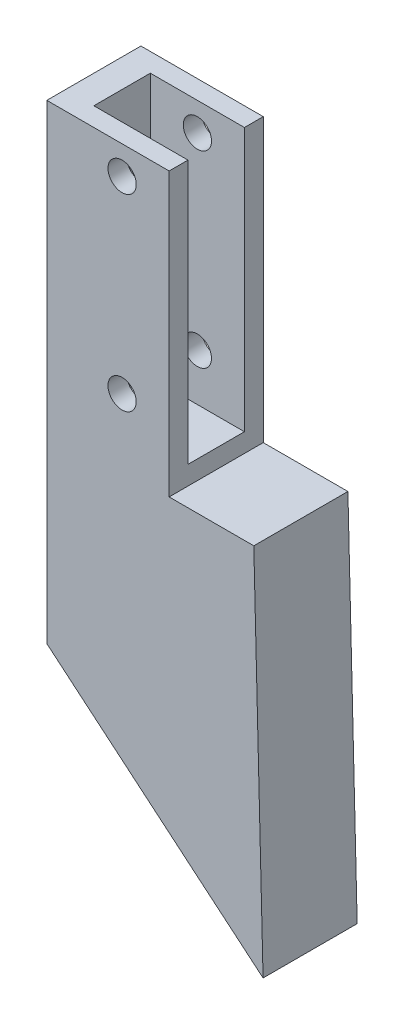
from build123d import *

# Parameters (mm, degrees)
SKETCH_1_W          = 13
SKETCH_1_H          = 30
EXTRUDE_1_DEPTH     = 10
SKETCH_2_W          = 6
SKETCH_2_H          = 28
CUT_EXTRUDE_1_DEPTH = 10
SKETCH_3_R          = 1.5
CUT_EXTRUDE_2_DEPTH = 58.605092201
SKETCH_4_R          = 1.5
CUT_EXTRUDE_3_DEPTH = 58.605092201


with BuildPart() as part:
    # 草图1 → 凸台-拉伸1 (new body)
    with BuildSketch(Plane.XY):
        Rectangle(SKETCH_1_W, SKETCH_1_H)
        Polygon((16.481333294, -54.283628291), (15.495607284, -15), (6.5, -15), (-6.5, -15), (-6.5, -35), align=None)
    extrude(amount=EXTRUDE_1_DEPTH)

    # 草图2 → 切除-拉伸1 (cut)
    with BuildSketch(Plane(origin=(6.5, 0, 0), x_dir=(0, 0, -1), z_dir=(1, 0, 0))):
        with Locations((-5, 1)):
            Rectangle(SKETCH_2_W, SKETCH_2_H)
    extrude(amount=-CUT_EXTRUDE_1_DEPTH, mode=Mode.SUBTRACT)

    # 草图3 → 切除-拉伸2 (cut, through all)
    with BuildSketch(Plane.XY.offset(10)):
        with Locations((1.5, 12)):
            Circle(SKETCH_3_R)
    extrude(amount=-CUT_EXTRUDE_2_DEPTH, mode=Mode.SUBTRACT)

    # 草图4 → 切除-拉伸3 (cut, through all)
    with BuildSketch(Plane.XY.offset(10)):
        with Locations((1.5, -8)):
            Circle(SKETCH_4_R)
    extrude(amount=-CUT_EXTRUDE_3_DEPTH, mode=Mode.SUBTRACT)


solid = part.part
